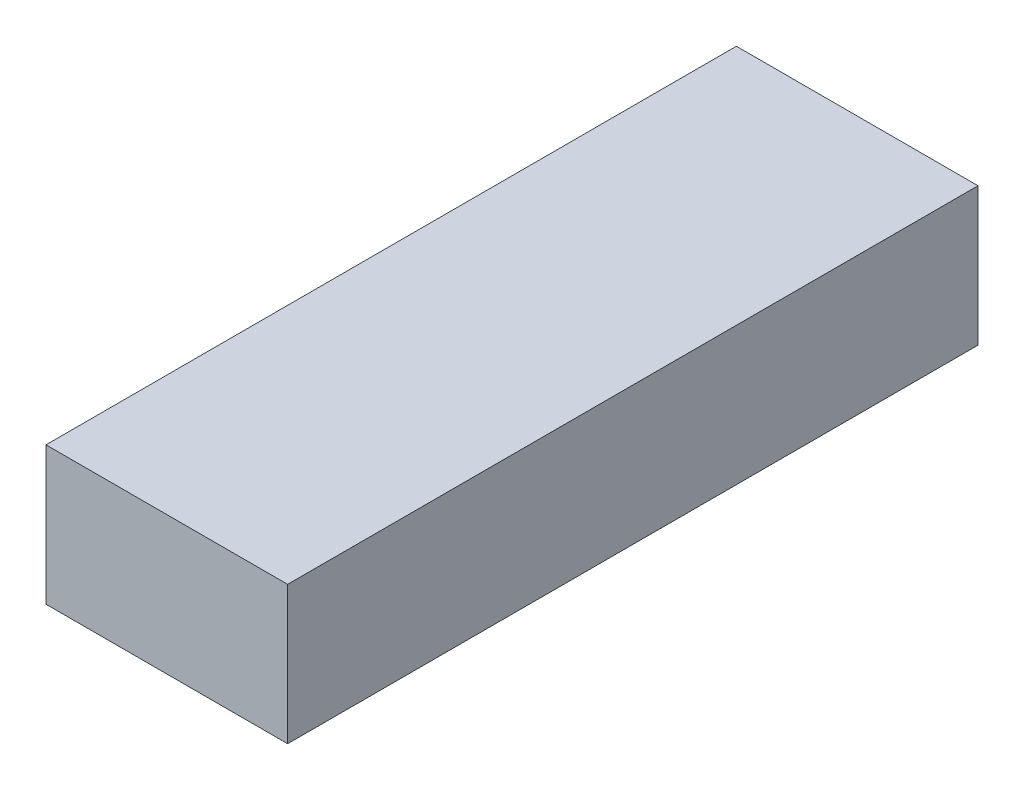
from build123d import *

# Parameters (mm, degrees)
SKETCH1_W           = 4.445
SKETCH1_H           = 2.54
BOSS_EXTRUDE1_DEPTH = 12.7


with BuildPart() as part:
    # Sketch1 → Boss-Extrude1 (new body)
    with BuildSketch(Plane.XY):
        with Locations((-2.2225, 1.27)):
            Rectangle(SKETCH1_W, SKETCH1_H)
    extrude(amount=BOSS_EXTRUDE1_DEPTH)


solid = part.part
